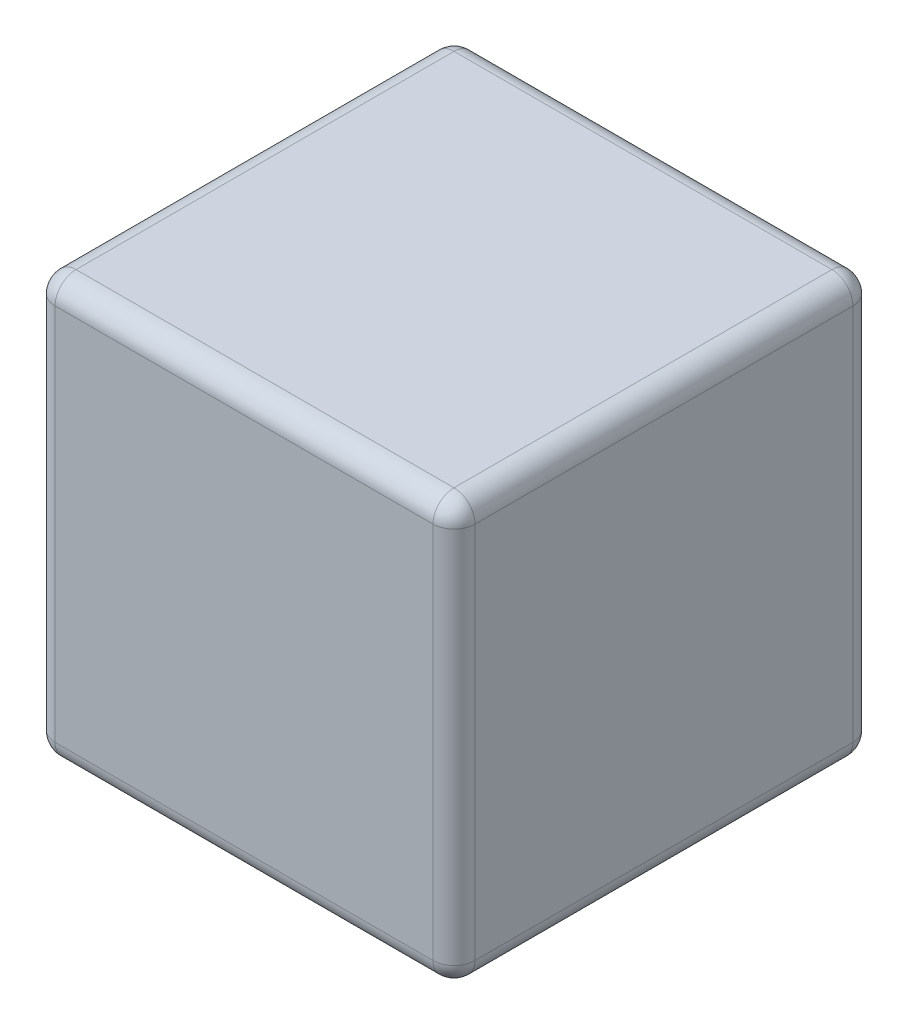
from build123d import *

# Parameters (mm, degrees)
SKETCH1_W           = 40
SKETCH1_H           = 40
BOSS_EXTRUDE1_DEPTH = 40
FILLET1_R           = 2


with BuildPart() as part:
    # Sketch1 → Boss-Extrude1 (new body)
    with BuildSketch(Plane.XY):
        Rectangle(SKETCH1_W, SKETCH1_H)
    extrude(amount=BOSS_EXTRUDE1_DEPTH)

    # Fillet1
    fillet1_edges = [part.edges().sort_by_distance(p)[0] for p in [
        (-20, 0, 40),
        (0, -20, 40),
        (20, 0, 40),
        (0, -20, 0),
        (-20, 0, 0),
        (0, 20, 0),
        (20, 0, 0),
        (0, 20, 40),
        (20, -20, 20),
        (-20, -20, 20),
        (-20, 20, 20),
        (20, 20, 20),
    ]]
    fillet(fillet1_edges, radius=FILLET1_R)


solid = part.part
